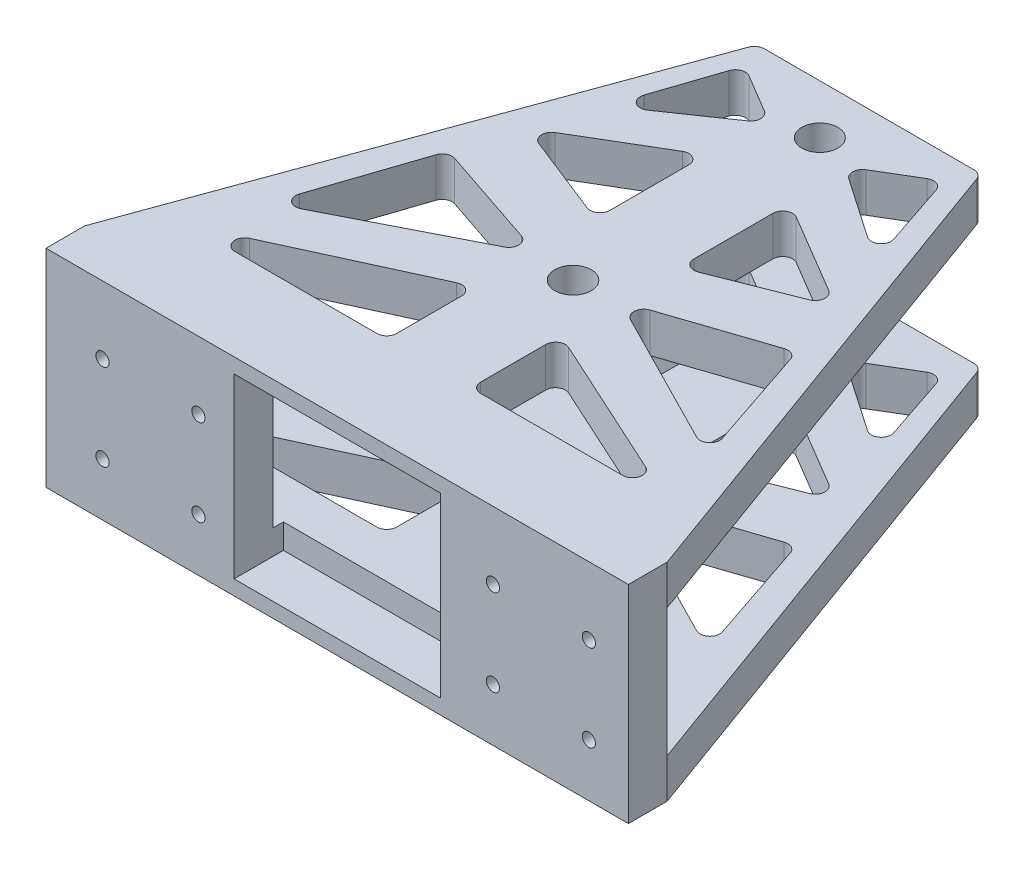
from build123d import *

# Parameters (mm, degrees)
SKETCH1_W           = 150
SKETCH1_H           = 53.34
BOSS_EXTRUDE1_DEPTH = 10
SKETCH4_W           = 150
SKETCH4_H           = 10.16
BOSS_EXTRUDE3_DEPTH = 127
CUT_EXTRUDE1_DEPTH  = 83.82
FILLET1_R           = 2.54
SKETCH7_R           = 4.649830258
CUT_EXTRUDE2_DEPTH  = 83.82
SKETCH8_W           = 53.10558352
SKETCH8_H           = 45.72
CUT_EXTRUDE3_DEPTH  = 12.7
CUT_EXTRUDE4_DEPTH  = 157.841179542
FILLET2_R           = 2.54
FILLET3_R           = 2.54
CUT_EXTRUDE5_REACH  = 160.446
SKETCH10_R          = 1.7
SKETCH11_R          = 4.699
CUT_EXTRUDE6_DEPTH  = 157.841179542


with BuildPart() as part:
    # Sketch1 → Boss-Extrude1 (new body)
    with BuildSketch(Plane.XY):
        Rectangle(SKETCH1_W, SKETCH1_H)
    extrude(amount=BOSS_EXTRUDE1_DEPTH)

    # Sketch4 → Boss-Extrude3 (add)
    with BuildSketch(Plane(origin=(0, 0, 0), x_dir=(-1, 0, 0), z_dir=(0, 0, -1))):
        with Locations((0, 21.59)):
            Rectangle(SKETCH4_W, SKETCH4_H)
        with Locations((0, -21.59)):
            Rectangle(SKETCH4_W, SKETCH4_H)
    extrude(amount=BOSS_EXTRUDE3_DEPTH)

    # Sketch6 → Cut-Extrude1 (cut)
    with BuildSketch(Plane(origin=(0, 26.67, 0), x_dir=(1, 0, 0), z_dir=(0, 1, 0))):
        Polygon((28.775780248, 127), (75, 0), (75, 127), align=None)
        Polygon((-75, 0), (-75, 127), (-28.775780248, 127), align=None)
    extrude(amount=-CUT_EXTRUDE1_DEPTH, mode=Mode.SUBTRACT)

    # Fillet1
    fillet1_edges = [part.edges().sort_by_distance(p)[0] for p in [
        (28.775780248, 21.59, -127),
        (-28.775780248, 21.59, -127),
        (-28.775780248, -21.59, -127),
        (28.775780248, -21.59, -127),
    ]]
    fillet(fillet1_edges, radius=FILLET1_R)

    # Sketch7 → Cut-Extrude2 (cut)
    with BuildSketch(Plane(origin=(0, 26.67, 0), x_dir=(1, 0, 0), z_dir=(0, 1, 0))):
        with Locations(Location((0, 114.3, 0), (0, 0, 270))):
            Circle(SKETCH7_R)
    extrude(amount=-CUT_EXTRUDE2_DEPTH, mode=Mode.SUBTRACT)

    # Sketch8 → Cut-Extrude3 (cut)
    with BuildSketch(Plane.XY.offset(10)):
        Rectangle(SKETCH8_W, SKETCH8_H)
    extrude(amount=-CUT_EXTRUDE3_DEPTH, mode=Mode.SUBTRACT)

    # Sketch9 → Cut-Extrude4 (cut, through all)
    with BuildSketch(Plane(origin=(0, 26.67, 0), x_dir=(1, 0, 0), z_dir=(0, 1, 0))):
        Polygon((-34.586424408, 93.969139079), (-9.684580109, 111.082069913), (-25.640652678, 120.607649188), align=None)
        Polygon((-39.704336807, 78.729139079), (-10.827990436, 95.842069913), (-10.827990436, 67.313152305), align=None)
        Polygon((-10.827990436, 52.073152305), (-44.822249205, 63.489139079), (-56.460793416, 28.832153973), align=None)
        Polygon((-10.827990436, 36.833152305), (-61.578705814, 13.592153973), (-10.827990436, 13.592153973), align=None)
    cut_extrude4 = extrude(amount=-CUT_EXTRUDE4_DEPTH, mode=Mode.SUBTRACT)

    # Mirror1: Cut-Extrude4 across plane
    add(cut_extrude4.mirror(Plane(origin=(0, 0, 0), x_dir=(0, 0, 1), z_dir=(1, 0, 0))), mode=Mode.SUBTRACT)

    # Fillet2
    fillet2_edges = [part.edges().sort_by_distance(p)[0] for p in [
        (-10.827990436, 21.59, -67.313152305),
        (-39.704336807, -21.59, -78.729139079),
        (-39.704336807, 21.59, -78.729139079),
        (-10.827990436, 21.59, -95.842069913),
        (-10.827990436, 21.59, -52.073152305),
        (-56.460793416, 21.59, -28.832153973),
        (-44.822249205, 21.59, -63.489139079),
        (-10.827990436, 21.59, -36.833152305),
        (-10.827990436, 21.59, -13.592153973),
        (-61.578705814, 21.59, -13.592153973),
        (-34.586424408, 21.59, -93.969139079),
        (-25.640652678, 21.59, -120.607649188),
        (-9.684580109, 21.59, -111.082069913),
        (39.704336807, 21.59, -78.729139079),
        (10.827990436, 21.59, -67.313152305),
        (10.827990436, 21.59, -95.842069913),
        (56.460793416, 21.59, -28.832153973),
        (10.827990436, 21.59, -52.073152305),
        (44.822249205, 21.59, -63.489139079),
        (10.827990436, 21.59, -13.592153973),
        (10.827990436, 21.59, -36.833152305),
        (61.578705814, 21.59, -13.592153973),
        (25.640652678, 21.59, -120.607649188),
        (34.586424408, 21.59, -93.969139079),
        (9.684580109, -21.59, -111.082069913),
        (9.684580109, 21.59, -111.082069913),
    ]]
    fillet(fillet2_edges, radius=FILLET2_R)

    # Fillet3
    fillet3_edges = [part.edges().sort_by_distance(p)[0] for p in [
        (-10.827990436, -21.59, -67.313152305),
        (-10.827990436, -21.59, -95.842069913),
        (-10.827990436, -21.59, -52.073152305),
        (-56.460793416, -21.59, -28.832153973),
        (-44.822249205, -21.59, -63.489139079),
        (-10.827990436, -21.59, -36.833152305),
        (-10.827990436, -21.59, -13.592153973),
        (-61.578705814, -21.59, -13.592153973),
        (-34.586424408, -21.59, -93.969139079),
        (-25.640652678, -21.59, -120.607649188),
        (-9.684580109, -21.59, -111.082069913),
        (39.704336807, -21.59, -78.729139079),
        (10.827990436, -21.59, -67.313152305),
        (10.827990436, -21.59, -95.842069913),
        (56.460793416, -21.59, -28.832153973),
        (10.827990436, -21.59, -52.073152305),
        (44.822249205, -21.59, -63.489139079),
        (10.827990436, -21.59, -13.592153973),
        (10.827990436, -21.59, -36.833152305),
        (61.578705814, -21.59, -13.592153973),
        (25.640652678, -21.59, -120.607649188),
        (34.586424408, -21.59, -93.969139079),
    ]]
    fillet(fillet3_edges, radius=FILLET3_R)

    # Sketch10 → Cut-Extrude5 (cut, up to next)
    with BuildSketch(Plane.XY.offset(10), mode=Mode.PRIVATE) as cut_extrude5_sk1:
        with Locations((40.113762047, 9.239336029)):
            Circle(SKETCH10_R)
    cut_extrude5_tool1 = extrude(cut_extrude5_sk1.sketch, amount=-CUT_EXTRUDE5_REACH, mode=Mode.PRIVATE) & part.part
    # Sketch10 → Cut-Extrude5 (cut, up to next)
    with BuildSketch(Plane.XY.offset(10), mode=Mode.PRIVATE) as cut_extrude5_sk2:
        with Locations((64.827817703, 9.239336029)):
            Circle(SKETCH10_R)
    cut_extrude5_tool2 = extrude(cut_extrude5_sk2.sketch, amount=-CUT_EXTRUDE5_REACH, mode=Mode.PRIVATE) & part.part
    # Sketch10 → Cut-Extrude5 (cut, up to next)
    with BuildSketch(Plane.XY.offset(10), mode=Mode.PRIVATE) as cut_extrude5_sk3:
        with Locations((64.827817703, -13.049336029)):
            Circle(SKETCH10_R)
    cut_extrude5_tool3 = extrude(cut_extrude5_sk3.sketch, amount=-CUT_EXTRUDE5_REACH, mode=Mode.PRIVATE) & part.part
    # Sketch10 → Cut-Extrude5 (cut, up to next)
    with BuildSketch(Plane.XY.offset(10), mode=Mode.PRIVATE) as cut_extrude5_sk4:
        with Locations((40.113762047, -13.049336029)):
            Circle(SKETCH10_R)
    cut_extrude5_tool4 = extrude(cut_extrude5_sk4.sketch, amount=-CUT_EXTRUDE5_REACH, mode=Mode.PRIVATE) & part.part
    # Sketch10 → Cut-Extrude5 (cut, up to next)
    with BuildSketch(Plane.XY.offset(10), mode=Mode.PRIVATE) as cut_extrude5_sk5:
        with Locations((-60.450241723, 9.239336029)):
            Circle(SKETCH10_R)
    cut_extrude5_tool5 = extrude(cut_extrude5_sk5.sketch, amount=-CUT_EXTRUDE5_REACH, mode=Mode.PRIVATE) & part.part
    # Sketch10 → Cut-Extrude5 (cut, up to next)
    with BuildSketch(Plane.XY.offset(10), mode=Mode.PRIVATE) as cut_extrude5_sk6:
        with Locations((-35.736186067, 9.239336029)):
            Circle(SKETCH10_R)
    cut_extrude5_tool6 = extrude(cut_extrude5_sk6.sketch, amount=-CUT_EXTRUDE5_REACH, mode=Mode.PRIVATE) & part.part
    # Sketch10 → Cut-Extrude5 (cut, up to next)
    with BuildSketch(Plane.XY.offset(10), mode=Mode.PRIVATE) as cut_extrude5_sk7:
        with Locations((-35.736186067, -13.049336029)):
            Circle(SKETCH10_R)
    cut_extrude5_tool7 = extrude(cut_extrude5_sk7.sketch, amount=-CUT_EXTRUDE5_REACH, mode=Mode.PRIVATE) & part.part
    # Sketch10 → Cut-Extrude5 (cut, up to next)
    with BuildSketch(Plane.XY.offset(10), mode=Mode.PRIVATE) as cut_extrude5_sk8:
        with Locations((-60.450241723, -13.049336029)):
            Circle(SKETCH10_R)
    cut_extrude5_tool8 = extrude(cut_extrude5_sk8.sketch, amount=-CUT_EXTRUDE5_REACH, mode=Mode.PRIVATE) & part.part
    add(cut_extrude5_tool1.solids().sort_by_distance((40.113762, 9.239336, 10))[0], mode=Mode.SUBTRACT)
    add(cut_extrude5_tool2.solids().sort_by_distance((64.827818, 9.239336, 10))[0], mode=Mode.SUBTRACT)
    add(cut_extrude5_tool3.solids().sort_by_distance((64.827818, -13.049336, 10))[0], mode=Mode.SUBTRACT)
    add(cut_extrude5_tool4.solids().sort_by_distance((40.113762, -13.049336, 10))[0], mode=Mode.SUBTRACT)
    add(cut_extrude5_tool5.solids().sort_by_distance((-60.450242, 9.239336, 10))[0], mode=Mode.SUBTRACT)
    add(cut_extrude5_tool6.solids().sort_by_distance((-35.736186, 9.239336, 10))[0], mode=Mode.SUBTRACT)
    add(cut_extrude5_tool7.solids().sort_by_distance((-35.736186, -13.049336, 10))[0], mode=Mode.SUBTRACT)
    add(cut_extrude5_tool8.solids().sort_by_distance((-60.450242, -13.049336, 10))[0], mode=Mode.SUBTRACT)

    # Sketch11 → Cut-Extrude6 (cut, through all)
    with BuildSketch(Plane(origin=(0, 26.67, 0), x_dir=(1, 0, 0), z_dir=(0, 1, 0))):
        with Locations(Location((0, 50.739787161, 0), (0, 0, 270))):
            Circle(SKETCH11_R)
    extrude(amount=-CUT_EXTRUDE6_DEPTH, mode=Mode.SUBTRACT)


solid = part.part
